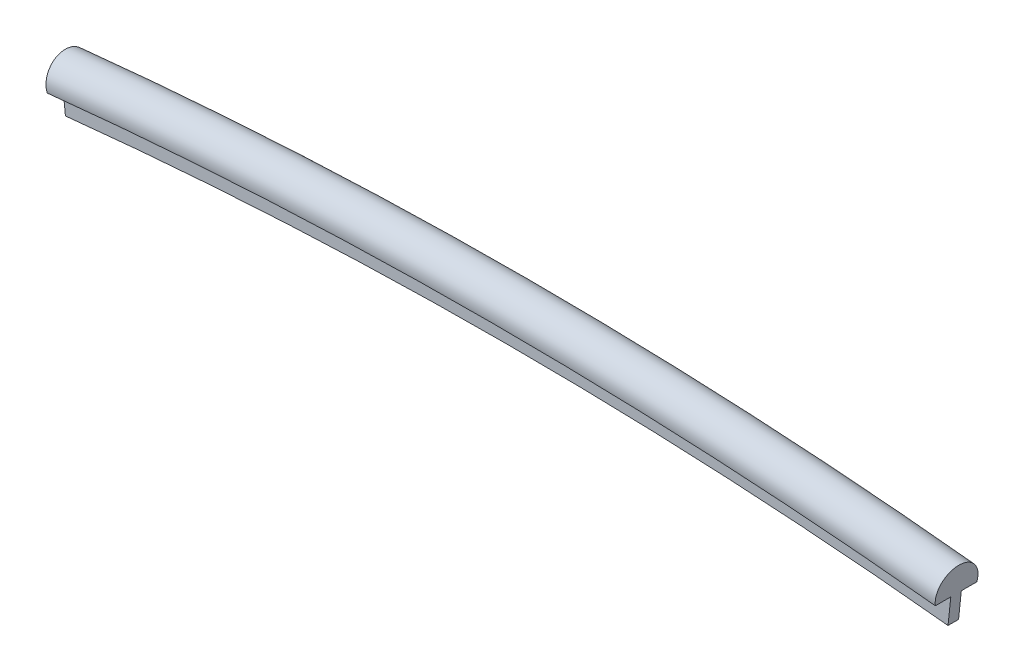
from build123d import *

# Parameters (mm, degrees)
REVOLVE1_ANGLE           = 6.018080225
REVOLVE1_OTHER_WAY_ANGLE = 6.018080225


with BuildPart() as part:
    # Sketch2 → Revolve1 (revolve)
    with BuildSketch(Plane(origin=(0, 0, 0), x_dir=(0, 0, -1), z_dir=(1, 0, 0))):
        with BuildLine():
            Line((0, 239.8), (0.3, 239.8))
            Line((0.3, 239.8), (0.3, 241.3))
            Line((0.3, 241.3), (1.18, 241.3))
            ThreePointArc((1.18, 241.3), (0, 242.800182019), (-1.18, 241.3))
            Line((-1.18, 241.3), (-0.3, 241.3))
            Line((-0.3, 241.3), (-0.3, 239.8))
            Line((-0.3, 239.8), (0, 239.8))
        make_face()
    revolve(axis=Axis((0, 0, 70.597641597), (0, 0, -1)), revolution_arc=REVOLVE1_ANGLE)

    # Sketch2 → Revolve1 other way (revolve)
    with BuildSketch(Plane(origin=(0, 0, 0), x_dir=(0, 0, -1), z_dir=(1, 0, 0))):
        with BuildLine():
            Line((0, 239.8), (0.3, 239.8))
            Line((0.3, 239.8), (0.3, 241.3))
            Line((0.3, 241.3), (1.18, 241.3))
            ThreePointArc((1.18, 241.3), (0, 242.800182019), (-1.18, 241.3))
            Line((-1.18, 241.3), (-0.3, 241.3))
            Line((-0.3, 241.3), (-0.3, 239.8))
            Line((-0.3, 239.8), (0, 239.8))
        make_face()
    revolve(axis=Axis((0, 0, 70.597641597), (0, 0, 1)), revolution_arc=REVOLVE1_OTHER_WAY_ANGLE)


solid = part.part
